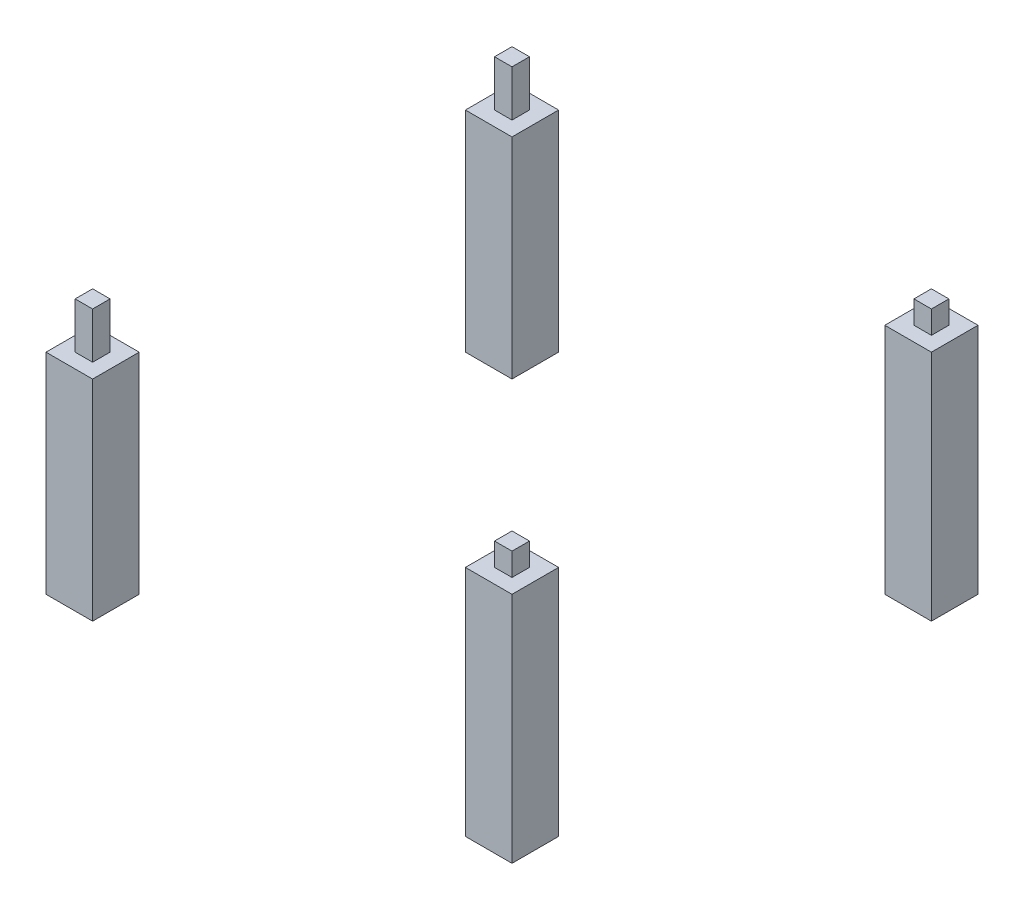
from build123d import *

# Parameters (mm, degrees)
CROQUIS2_W                = 20
CROQUIS2_H                = 20
SALIENTE_EXTRUIR3_DEPTH   = 90
SALIENTE_EXTRUIR3_2_DEPTH = 90
CROQUIS5_W                = 20
CROQUIS5_H                = 20
SALIENTE_EXTRUIR4_DEPTH   = 100
SALIENTE_EXTRUIR4_2_DEPTH = 100
CROQUIS6_W                = 7.5
CROQUIS6_H                = 7.5
SALIENTE_EXTRUIR5_DEPTH   = 9.8
CROQUIS7_W                = 7.5
CROQUIS7_H                = 7.5
SALIENTE_EXTRUIR6_DEPTH   = 19.8


with BuildPart() as part:
    # Croquis2 → Saliente-Extruir3 (new body)
    with BuildSketch(Plane(origin=(0, 0, 0), x_dir=(1, 0, 0), z_dir=(0, 1, 0))):
        with Locations((-90, -90)):
            Rectangle(CROQUIS2_W, CROQUIS2_H)
    extrude(amount=SALIENTE_EXTRUIR3_DEPTH)



with BuildPart() as body_2:
    # Croquis2 → Saliente-Extruir3 2 (new body)
    with BuildSketch(Plane(origin=(0, 0, 0), x_dir=(1, 0, 0), z_dir=(0, 1, 0))):
        with Locations((-90, 90)):
            Rectangle(CROQUIS2_W, CROQUIS2_H)
    extrude(amount=SALIENTE_EXTRUIR3_2_DEPTH)


with BuildPart() as body_3:
    # Croquis5 → Saliente-Extruir4 (new body)
    with BuildSketch(Plane(origin=(0, 0, 0), x_dir=(1, 0, 0), z_dir=(0, 1, 0))):
        with Locations((90, -90)):
            Rectangle(CROQUIS5_W, CROQUIS5_H)
    extrude(amount=SALIENTE_EXTRUIR4_DEPTH)



with BuildPart() as body_4:
    # Croquis5 → Saliente-Extruir4 2 (new body)
    with BuildSketch(Plane(origin=(0, 0, 0), x_dir=(1, 0, 0), z_dir=(0, 1, 0))):
        with Locations((90, 90)):
            Rectangle(CROQUIS5_W, CROQUIS5_H)
    extrude(amount=SALIENTE_EXTRUIR4_2_DEPTH)


with BuildPart() as body_3_1:
    add(body_3.part)

    add(body_4.part)  # Saliente-Extruir5 merges body 4
    # Croquis6 → Saliente-Extruir5 (add)
    with BuildSketch(Plane(origin=(0, 100, 0), x_dir=(1, 0, 0), z_dir=(0, 1, 0))):
        with Locations((90, -90)):
            Rectangle(CROQUIS6_W, CROQUIS6_H)
        with Locations((90, 90)):
            Rectangle(CROQUIS6_W, CROQUIS6_H)
    extrude(amount=SALIENTE_EXTRUIR5_DEPTH)


with BuildPart() as part_1:
    add(part.part)

    add(body_2.part)  # Saliente-Extruir6 merges body 2
    # Croquis7 → Saliente-Extruir6 (add)
    with BuildSketch(Plane(origin=(0, 90, 0), x_dir=(1, 0, 0), z_dir=(0, 1, 0))):
        with Locations((-90, -90)):
            Rectangle(CROQUIS7_W, CROQUIS7_H)
        with Locations((-90, 90)):
            Rectangle(CROQUIS7_W, CROQUIS7_H)
    extrude(amount=SALIENTE_EXTRUIR6_DEPTH)


solid = Compound([body_3_1.part, part_1.part])
